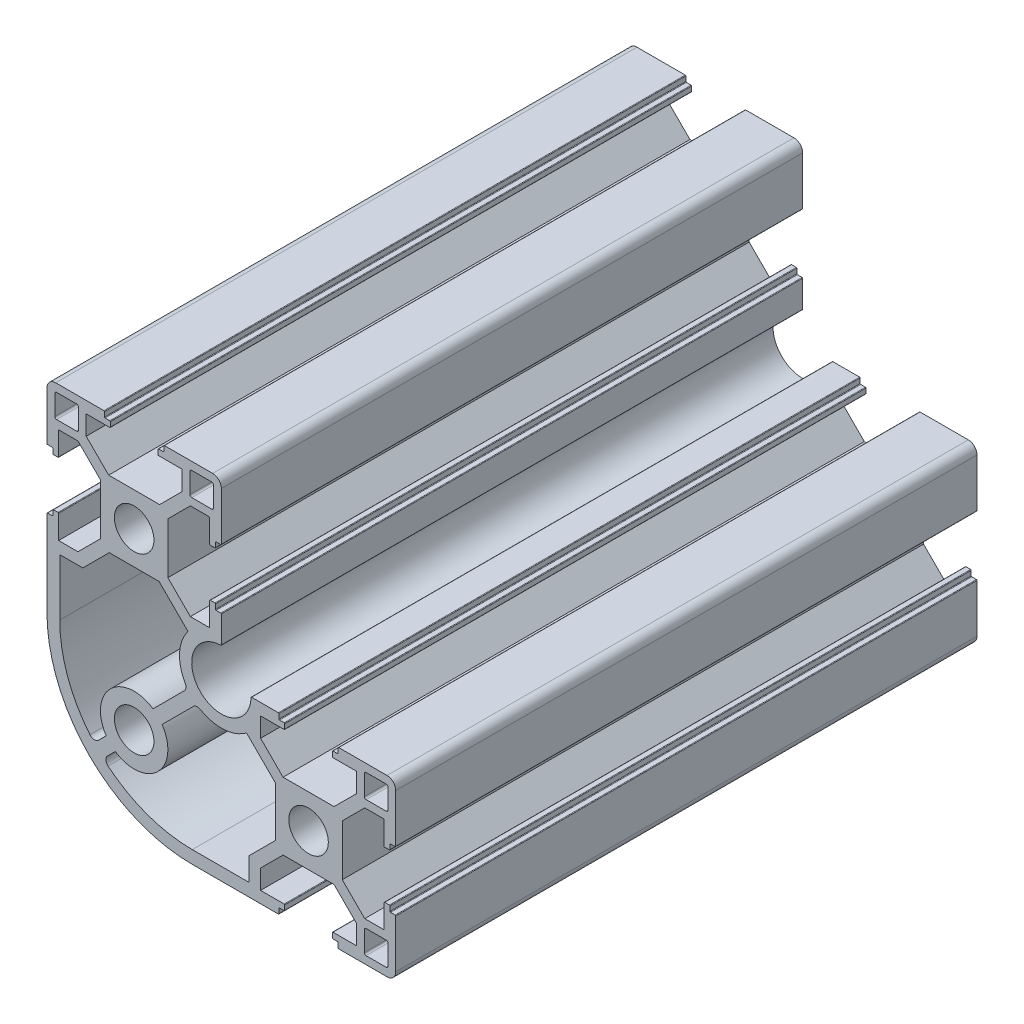
from build123d import *

# Parameters (mm, degrees)
SKETCH_1_R      = 3.4
EXTRUDE_1_DEPTH = 100


with BuildPart() as part:
    # 草图1 → 凸台-拉伸1 (new body)
    with BuildSketch(Plane.XY):
        with BuildLine():
            Line((19.991828682, 34.368586454), (19.991828682, 38.96954808))
            ThreePointArc((19.991828682, 38.96954808), (19.96253936, 39.040258759), (19.891828682, 39.069548081))
            Line((19.891828682, 39.069548081), (19.091828684, 39.069548081))
            ThreePointArc((19.091828684, 39.069548081), (19.021118005, 39.098837403), (18.991828683, 39.169548081))
            Line((18.991828683, 39.169548081), (18.991828683, 39.969548082))
            ThreePointArc((18.991828683, 39.969548082), (18.962539362, 40.04025876), (18.891828683, 40.06954808))
            Line((18.891828683, 40.06954808), (18.091828682, 40.069548082))
            ThreePointArc((18.091828682, 40.069548082), (18.021118004, 40.04025876), (17.991828682, 39.969548082))
            Line((17.991828682, 39.969548082), (17.991828682, 35.919548081))
            Line((17.991828682, 35.919548081), (14.656042244, 35.919548081))
            Line((14.656042244, 35.919548081), (10.791828682, 39.783761643))
            Line((10.791828682, 39.783761643), (10.791828682, 48.555334519))
            Line((10.791828682, 48.555334519), (14.656042244, 52.419548081))
            Line((14.656042244, 52.419548081), (17.991828682, 52.419548081))
            Line((17.991828682, 52.419548081), (17.991828682, 48.369548081))
            ThreePointArc((17.991828682, 48.369548081), (18.021118004, 48.298837402), (18.091828682, 48.26954808))
            Line((18.091828682, 48.26954808), (18.891828683, 48.26954808))
            ThreePointArc((18.891828683, 48.26954808), (18.962539361, 48.298837402), (18.991828683, 48.369548081))
            Line((18.991828683, 48.369548081), (18.991828683, 49.169548081))
            ThreePointArc((18.991828683, 49.169548081), (19.021118005, 49.24025876), (19.091828684, 49.269548082))
            Line((19.091828684, 49.269548082), (19.891828682, 49.269548079))
            ThreePointArc((19.891828682, 49.269548079), (19.96253936, 49.298837401), (19.991828682, 49.36954808))
            Line((19.991828682, 49.36954808), (19.991828682, 57.669548081))
            ThreePointArc((19.991828682, 57.669548081), (19.552488854, 58.730208253), (18.491828683, 59.169548081))
            Line((18.491828683, 59.169548081), (10.191828684, 59.169548081))
            ThreePointArc((10.191828684, 59.169548081), (10.121118005, 59.140258759), (10.091828683, 59.069548081))
            Line((10.091828683, 59.069548081), (10.091828683, 58.26954808))
            ThreePointArc((10.091828683, 58.26954808), (10.062539361, 58.198837402), (9.991828682, 58.16954808))
            Line((9.991828682, 58.16954808), (9.191828682, 58.169548082))
            ThreePointArc((9.191828682, 58.169548082), (9.121118004, 58.140258761), (9.091828684, 58.069548082))
            Line((9.091828684, 58.069548082), (9.091828681, 57.269548081))
            ThreePointArc((9.091828681, 57.269548081), (9.121118004, 57.198837403), (9.191828682, 57.169548081))
            Line((9.191828682, 57.169548081), (13.241828682, 57.169548081))
            Line((13.241828682, 57.169548081), (13.241828682, 53.833761643))
            Line((13.241828682, 53.833761643), (9.37761512, 49.969548081))
            Line((9.37761512, 49.969548081), (0.606042244, 49.969548081))
            Line((0.606042244, 49.969548081), (-3.258171318, 53.833761643))
            Line((-3.258171318, 53.833761643), (-3.258171318, 57.169548081))
            Line((-3.258171318, 57.169548081), (0.791828683, 57.169548081))
            ThreePointArc((0.791828683, 57.169548081), (0.862539361, 57.198837403), (0.891828683, 57.269548081))
            Line((0.891828683, 57.269548081), (0.891828683, 58.069548082))
            ThreePointArc((0.891828683, 58.069548082), (0.862539361, 58.14025876), (0.791828683, 58.16954808))
            Line((0.791828683, 58.16954808), (-0.008171318, 58.16954808))
            ThreePointArc((-0.008171318, 58.16954808), (-0.078881996, 58.198837402), (-0.108171318, 58.26954808))
            Line((-0.108171318, 58.26954808), (-0.108171316, 59.069548081))
            ThreePointArc((-0.108171316, 59.069548081), (-0.137460638, 59.140258759), (-0.208171316, 59.169548081))
            Line((-0.208171316, 59.169548081), (-8.508171318, 59.169548081))
            ThreePointArc((-8.508171318, 59.169548081), (-9.568831489, 58.730208253), (-10.008171318, 57.669548081))
            Line((-10.008171318, 57.669548081), (-10.008171318, 49.36954808))
            ThreePointArc((-10.008171318, 49.36954808), (-9.978881996, 49.298837402), (-9.908171317, 49.269548082))
            Line((-9.908171317, 49.269548082), (-9.108171317, 49.269548082))
            ThreePointArc((-9.108171317, 49.269548082), (-9.037460638, 49.24025876), (-9.008171316, 49.169548081))
            Line((-9.008171316, 49.169548081), (-9.008171319, 48.369548081))
            ThreePointArc((-9.008171319, 48.369548081), (-8.978881997, 48.298837402), (-8.908171318, 48.26954808))
            Line((-8.908171318, 48.26954808), (-8.108171318, 48.26954808))
            ThreePointArc((-8.108171318, 48.26954808), (-8.037460639, 48.298837402), (-8.008171317, 48.369548081))
            Line((-8.008171317, 48.369548081), (-8.008171317, 52.419548081))
            Line((-8.008171317, 52.419548081), (-4.67238488, 52.419548081))
            Line((-4.67238488, 52.419548081), (-0.808171318, 48.555334519))
            Line((-0.808171318, 48.555334519), (-0.808171318, 39.783761643))
            Line((-0.808171318, 39.783761643), (-4.67238488, 35.919548081))
            Line((-4.67238488, 35.919548081), (-8.008171317, 35.919548081))
            Line((-8.008171317, 35.919548081), (-8.008171317, 39.969548082))
            ThreePointArc((-8.008171317, 39.969548082), (-8.037460639, 40.04025876), (-8.108171318, 40.06954808))
            Line((-8.108171318, 40.06954808), (-8.908171318, 40.069548082))
            ThreePointArc((-8.908171318, 40.069548082), (-8.978881996, 40.04025876), (-9.008171316, 39.969548082))
            Line((-9.008171316, 39.969548082), (-9.008171316, 39.169548081))
            ThreePointArc((-9.008171316, 39.169548081), (-9.037460638, 39.098837403), (-9.108171317, 39.069548081))
            Line((-9.108171317, 39.069548081), (-9.908171317, 39.069548081))
            ThreePointArc((-9.908171317, 39.069548081), (-9.978881996, 39.040258759), (-10.008171318, 38.96954808))
            Line((-10.008171318, 38.96954808), (-10.008171318, 24.169548081))
            ThreePointArc((-10.008171318, 24.169548081), (-2.685840847, 6.491878556), (14.991828682, -0.830451919))
            Line((14.991828682, -0.830451919), (29.791828683, -0.830451919))
            ThreePointArc((29.791828683, -0.830451919), (29.862539362, -0.801162597), (29.891828682, -0.730451918))
            Line((29.891828682, -0.730451918), (29.891828682, 0.06954808))
            ThreePointArc((29.891828682, 0.06954808), (29.921118004, 0.140258758), (29.991828682, 0.16954808))
            Line((29.991828682, 0.16954808), (30.791828682, 0.16954808))
            ThreePointArc((30.791828682, 0.16954808), (30.862539361, 0.198837403), (30.891828683, 0.269548081))
            Line((30.891828683, 0.269548081), (30.891828683, 1.069548081))
            ThreePointArc((30.891828683, 1.069548081), (30.862539361, 1.14025876), (30.791828682, 1.169548082))
            Line((30.791828682, 1.169548082), (26.741828682, 1.169548082))
            Line((26.741828682, 1.169548082), (26.741828682, 4.505334519))
            Line((26.741828682, 4.505334519), (30.606042244, 8.369548081))
            Line((30.606042244, 8.369548081), (39.37761512, 8.369548081))
            Line((39.37761512, 8.369548081), (43.241828682, 4.505334519))
            Line((43.241828682, 4.505334519), (43.241828682, 1.169548082))
            Line((43.241828682, 1.169548082), (39.191828682, 1.169548082))
            ThreePointArc((39.191828682, 1.169548082), (39.121118004, 1.14025876), (39.091828684, 1.069548081))
            Line((39.091828684, 1.069548081), (39.091828681, 0.269548081))
            ThreePointArc((39.091828681, 0.269548081), (39.121118003, 0.198837403), (39.191828682, 0.16954808))
            Line((39.191828682, 0.16954808), (39.991828682, 0.16954808))
            ThreePointArc((39.991828682, 0.16954808), (40.062539361, 0.140258758), (40.091828683, 0.06954808))
            Line((40.091828683, 0.06954808), (40.091828683, -0.730451918))
            ThreePointArc((40.091828683, -0.730451918), (40.121118005, -0.801162596), (40.191828683, -0.830451919))
            Line((40.191828683, -0.830451919), (48.491828682, -0.830451919))
            ThreePointArc((48.491828682, -0.830451919), (49.552488854, -0.39111209), (49.991828682, 0.669548081))
            Line((49.991828682, 0.669548081), (49.991828685, 8.96954808))
            ThreePointArc((49.991828685, 8.96954808), (49.962539363, 9.040258759), (49.891828684, 9.069548081))
            Line((49.891828684, 9.069548081), (49.091828684, 9.069548081))
            ThreePointArc((49.091828684, 9.069548081), (49.021118005, 9.098837403), (48.991828683, 9.169548081))
            Line((48.991828683, 9.169548081), (48.991828683, 9.969548082))
            ThreePointArc((48.991828683, 9.969548082), (48.962539361, 10.04025876), (48.891828682, 10.06954808))
            Line((48.891828682, 10.06954808), (48.091828682, 10.069548082))
            ThreePointArc((48.091828682, 10.069548082), (48.021118004, 10.04025876), (47.991828682, 9.969548082))
            Line((47.991828682, 9.969548082), (47.991828682, 5.919548082))
            Line((47.991828682, 5.919548082), (44.656042244, 5.919548082))
            Line((44.656042244, 5.919548082), (40.791828682, 9.783761643))
            Line((40.791828682, 9.783761643), (40.791828682, 18.555334519))
            Line((40.791828682, 18.555334519), (44.656042244, 22.419548081))
            Line((44.656042244, 22.419548081), (47.991828682, 22.419548081))
            Line((47.991828682, 22.419548081), (47.991828682, 18.369548081))
            ThreePointArc((47.991828682, 18.369548081), (48.021118004, 18.298837403), (48.091828682, 18.269548081))
            Line((48.091828682, 18.269548081), (48.891828682, 18.269548081))
            ThreePointArc((48.891828682, 18.269548081), (48.962539361, 18.298837403), (48.991828683, 18.369548081))
            Line((48.991828683, 18.369548081), (48.991828683, 19.169548081))
            ThreePointArc((48.991828683, 19.169548081), (49.021118005, 19.24025876), (49.091828684, 19.269548082))
            Line((49.091828684, 19.269548082), (49.891828684, 19.26954808))
            ThreePointArc((49.891828684, 19.26954808), (49.962539362, 19.298837401), (49.991828682, 19.36954808))
            Line((49.991828682, 19.36954808), (49.991828682, 27.669548082))
            ThreePointArc((49.991828682, 27.669548082), (49.552488854, 28.730208253), (48.491828682, 29.169548081))
            Line((48.491828682, 29.169548081), (40.191828683, 29.169548081))
            ThreePointArc((40.191828683, 29.169548081), (40.121118005, 29.140258759), (40.091828683, 29.069548081))
            Line((40.091828683, 29.069548081), (40.091828683, 28.26954808))
            ThreePointArc((40.091828683, 28.26954808), (40.062539361, 28.198837402), (39.991828682, 28.16954808))
            Line((39.991828682, 28.16954808), (39.191828682, 28.169548082))
            ThreePointArc((39.191828682, 28.169548082), (39.121118004, 28.140258761), (39.091828684, 28.069548082))
            Line((39.091828684, 28.069548082), (39.091828681, 27.269548082))
            ThreePointArc((39.091828681, 27.269548082), (39.121118003, 27.198837403), (39.191828682, 27.169548081))
            Line((39.191828682, 27.169548081), (43.241828682, 27.169548081))
            Line((43.241828682, 27.169548081), (43.241828682, 23.833761643))
            Line((43.241828682, 23.833761643), (39.37761512, 19.969548082))
            Line((39.37761512, 19.969548082), (30.606042244, 19.969548082))
            Line((30.606042244, 19.969548082), (26.741828682, 23.833761643))
            Line((26.741828682, 23.833761643), (26.741828682, 27.169548081))
            Line((26.741828682, 27.169548081), (30.791828682, 27.169548081))
            ThreePointArc((30.791828682, 27.169548081), (30.862539361, 27.198837403), (30.891828683, 27.269548082))
            Line((30.891828683, 27.269548082), (30.891828683, 28.069548082))
            ThreePointArc((30.891828683, 28.069548082), (30.862539361, 28.14025876), (30.791828682, 28.16954808))
            Line((30.791828682, 28.16954808), (29.991828682, 28.16954808))
            ThreePointArc((29.991828682, 28.16954808), (29.921118004, 28.198837402), (29.891828682, 28.26954808))
            Line((29.891828682, 28.26954808), (29.891828684, 29.069548081))
            ThreePointArc((29.891828684, 29.069548081), (29.862539362, 29.140258759), (29.791828683, 29.169548081))
            Line((29.791828683, 29.169548081), (25.190867055, 29.169548081))
            ThreePointArc((25.190867055, 29.169548081), (25.120839588, 29.140935432), (25.090885548, 29.071471158))
            ThreePointArc((25.090885548, 29.071471158), (16.385584098, 25.563303497), (19.893751759, 34.268604947))
            ThreePointArc((19.893751759, 34.268604947), (19.963216033, 34.298558987), (19.991828682, 34.368586454))
        make_face()
        with Locations((4.991828682, 44.169548081)):
            Circle(SKETCH_1_R, mode=Mode.SUBTRACT)
        with Locations((4.991828682, 14.169548081)):
            Circle(SKETCH_1_R, mode=Mode.SUBTRACT)
        with Locations((34.991828682, 14.169548081)):
            Circle(SKETCH_1_R, mode=Mode.SUBTRACT)
        with BuildLine():
            Line((18.341828683, 53.769548081), (14.891828682, 53.769548081))
            ThreePointArc((14.891828682, 53.769548081), (14.679696648, 53.857416047), (14.591828682, 54.069548081))
            Line((14.591828682, 54.069548081), (14.591828682, 57.519548082))
            ThreePointArc((14.591828682, 57.519548082), (14.679696648, 57.731680116), (14.891828682, 57.819548081))
            Line((14.891828682, 57.819548081), (18.341828683, 57.819548081))
            ThreePointArc((18.341828683, 57.819548081), (18.553960717, 57.731680116), (18.641828682, 57.519548082))
            Line((18.641828682, 57.519548082), (18.641828682, 54.069548081))
            ThreePointArc((18.641828682, 54.069548081), (18.553960717, 53.857416047), (18.341828683, 53.769548081))
        make_face(mode=Mode.SUBTRACT)
        with BuildLine():
            Line((-8.658171318, 54.069548081), (-8.658171318, 57.519548082))
            ThreePointArc((-8.658171318, 57.519548082), (-8.570303352, 57.731680116), (-8.358171318, 57.819548081))
            Line((-8.358171318, 57.819548081), (-4.908171317, 57.819548081))
            ThreePointArc((-4.908171317, 57.819548081), (-4.696039283, 57.731680116), (-4.608171318, 57.519548082))
            Line((-4.608171318, 57.519548082), (-4.608171318, 54.069548081))
            ThreePointArc((-4.608171318, 54.069548081), (-4.696039283, 53.857416047), (-4.908171317, 53.769548081))
            Line((-4.908171317, 53.769548081), (-8.358171318, 53.769548081))
            ThreePointArc((-8.358171318, 53.769548081), (-8.570303352, 53.857416047), (-8.658171318, 54.069548081))
        make_face(mode=Mode.SUBTRACT)
        with BuildLine():
            Line((13.60910266, 24.342456978), (8.240796543, 18.974150857))
            ThreePointArc((8.240796543, 18.974150857), (0.890609353, 18.270767413), (0.187225905, 10.920580222))
            Line((0.187225905, 10.920580222), (-1.129228331, 9.604125985))
            ThreePointArc((-1.129228331, 9.604125985), (-1.884556346, 9.312396089), (-2.608269229, 9.675530231))
            ThreePointArc((-2.608269229, 9.675530231), (-6.46885901, 16.470269947), (-7.808171318, 24.169548081))
            Line((-7.808171318, 24.169548081), (-7.808171318, 33.919548081))
            Line((-7.808171318, 33.919548081), (-3.843957756, 33.919548081))
            Line((-3.843957756, 33.919548081), (0.706042245, 38.469548082))
            Line((0.706042245, 38.469548082), (9.27761512, 38.469548082))
            Line((9.27761512, 38.469548082), (14.242896835, 33.504266366))
            ThreePointArc((14.242896835, 33.504266366), (12.804707977, 29.600008256), (13.766609636, 25.552000872))
            ThreePointArc((13.766609636, 25.552000872), (13.893623566, 24.920433863), (13.60910266, 24.342456978))
        make_face(mode=Mode.SUBTRACT)
        with BuildLine():
            Line((24.326546967, 23.420616234), (29.291828683, 18.455334519))
            Line((29.291828683, 18.455334519), (29.291828683, 9.883761644))
            Line((29.291828683, 9.883761644), (24.741828682, 5.333761643))
            Line((24.741828682, 5.333761643), (24.741828682, 1.369548081))
            Line((24.741828682, 1.369548081), (14.991828682, 1.369548081))
            ThreePointArc((14.991828682, 1.369548081), (7.292550548, 2.708860393), (0.497810831, 6.569450168))
            ThreePointArc((0.497810831, 6.569450168), (0.13467669, 7.293163053), (0.426406588, 8.048491068))
            Line((0.426406588, 8.048491068), (1.742860824, 9.364945303))
            ThreePointArc((1.742860824, 9.364945303), (9.093048014, 10.068328751), (9.79643146, 17.418515941))
            Line((9.79643146, 17.418515941), (15.16473758, 22.786822058))
            ThreePointArc((15.16473758, 22.786822058), (15.742714464, 23.071342965), (16.374281473, 22.944329035))
            ThreePointArc((16.374281473, 22.944329035), (20.422288857, 21.982427376), (24.326546967, 23.420616234))
        make_face(mode=Mode.SUBTRACT)
        with BuildLine():
            Line((48.341828683, 0.519548081), (44.891828681, 0.519548081))
            ThreePointArc((44.891828681, 0.519548081), (44.679696648, 0.607416047), (44.591828682, 0.819548081))
            Line((44.591828682, 0.819548081), (44.591828682, 4.269548082))
            ThreePointArc((44.591828682, 4.269548082), (44.679696648, 4.481680116), (44.891828681, 4.569548082))
            Line((44.891828681, 4.569548082), (48.341828683, 4.569548082))
            ThreePointArc((48.341828683, 4.569548082), (48.553960717, 4.481680116), (48.641828682, 4.269548082))
            Line((48.641828682, 4.269548082), (48.641828682, 0.819548081))
            ThreePointArc((48.641828682, 0.819548081), (48.553960717, 0.607416047), (48.341828683, 0.519548081))
        make_face(mode=Mode.SUBTRACT)
        with BuildLine():
            Line((48.341828683, 23.769548081), (44.891828681, 23.769548081))
            ThreePointArc((44.891828681, 23.769548081), (44.679696648, 23.857416047), (44.591828682, 24.069548081))
            Line((44.591828682, 24.069548081), (44.591828682, 27.519548082))
            ThreePointArc((44.591828682, 27.519548082), (44.679696648, 27.731680116), (44.891828681, 27.819548081))
            Line((44.891828681, 27.819548081), (48.341828683, 27.819548081))
            ThreePointArc((48.341828683, 27.819548081), (48.553960717, 27.731680116), (48.641828682, 27.519548082))
            Line((48.641828682, 27.519548082), (48.641828682, 24.069548081))
            ThreePointArc((48.641828682, 24.069548081), (48.553960717, 23.857416047), (48.341828683, 23.769548081))
        make_face(mode=Mode.SUBTRACT)
    extrude(amount=EXTRUDE_1_DEPTH)


solid = part.part
